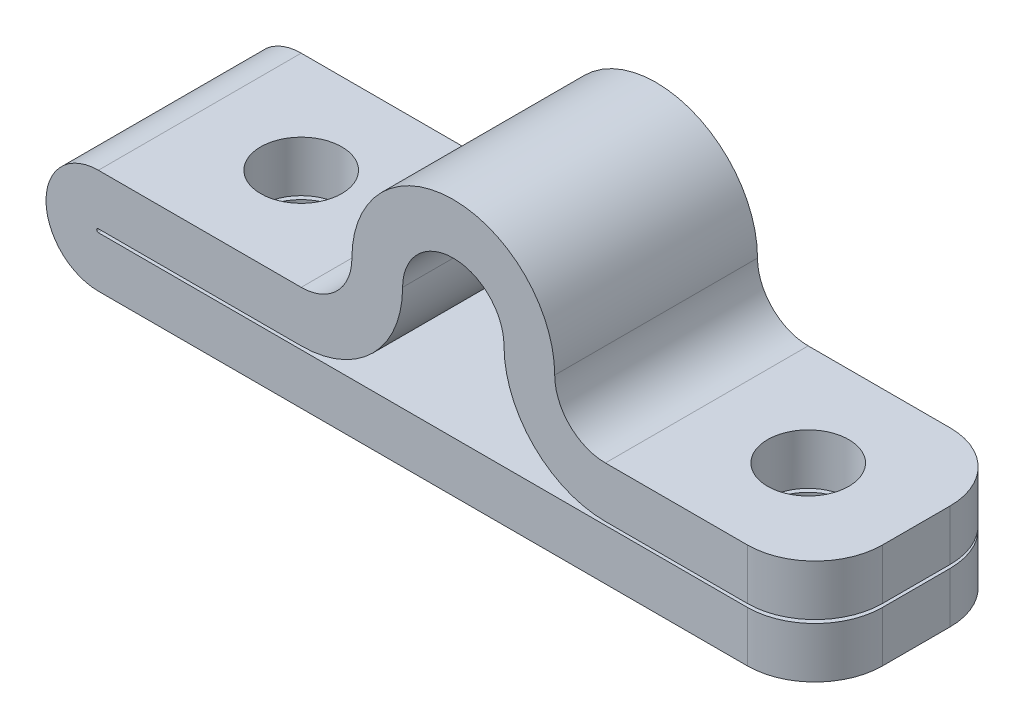
from build123d import *

# Parameters (mm, degrees)
BOSS_EXTRUDE1_DEPTH  = 3
M2_CLEARANCE_HOLE1_D = 2.4
FILLET1_R            = 2


with BuildPart() as part:
    # Sketch1 → Boss-Extrude1 (new, symmetric)
    with BuildSketch(Plane.XY):
        with BuildLine():
            ThreePointArc((4.5, 3.1), (3.439339828, 3.539339828), (3, 4.6))
            ThreePointArc((3, 4.6), (2.121320344, 6.721320344), (0, 7.6))
            ThreePointArc((0, 7.6), (-2.121320344, 6.721320344), (-3, 4.6))
            ThreePointArc((-3, 4.6), (-3.439339828, 3.539339828), (-4.5, 3.1))
            Line((-4.5, 3.1), (-10.5, 3.1))
            ThreePointArc((-10.5, 3.1), (-12.05, 1.55), (-10.5, 0))
            Line((-10.5, 0), (10.7, 0))
            Line((10.7, 0), (10.7, 1.5))
            Line((10.7, 1.5), (-10.5, 1.5))
            ThreePointArc((-10.5, 1.5), (-10.55, 1.55), (-10.5, 1.6))
            Line((-10.5, 1.6), (-4.5, 1.6))
            ThreePointArc((-4.5, 1.6), (-2.378679656, 2.478679656), (-1.5, 4.6))
            ThreePointArc((-1.5, 4.6), (-1.060660172, 5.660660172), (0, 6.1))
            ThreePointArc((0, 6.1), (1.060660172, 5.660660172), (1.5, 4.6))
            ThreePointArc((1.5, 4.6), (2.378679656, 2.478679656), (4.5, 1.6))
            Line((4.5, 1.6), (10.7, 1.6))
            Line((10.7, 1.6), (10.7, 3.1))
            Line((10.7, 3.1), (4.5, 3.1))
        make_face()
    extrude(amount=BOSS_EXTRUDE1_DEPTH, both=True)

    # M2 Clearance Hole1 (through all)
    with Locations(Plane(origin=(0, 3.1, 0), x_dir=(1, 0, 0), z_dir=(0, 1, 0))):
        with Locations((-7.5, 0), (7.5, 0)):
            Hole(M2_CLEARANCE_HOLE1_D / 2)

    # Fillet1
    fillet1_edges = [part.edges().sort_by_distance(p)[0] for p in [
        (10.7, 2.35, -3),
        (10.7, 0.75, -3),
        (10.7, 0.75, 3),
        (10.7, 2.35, 3),
    ]]
    fillet(fillet1_edges, radius=FILLET1_R)


solid = part.part
